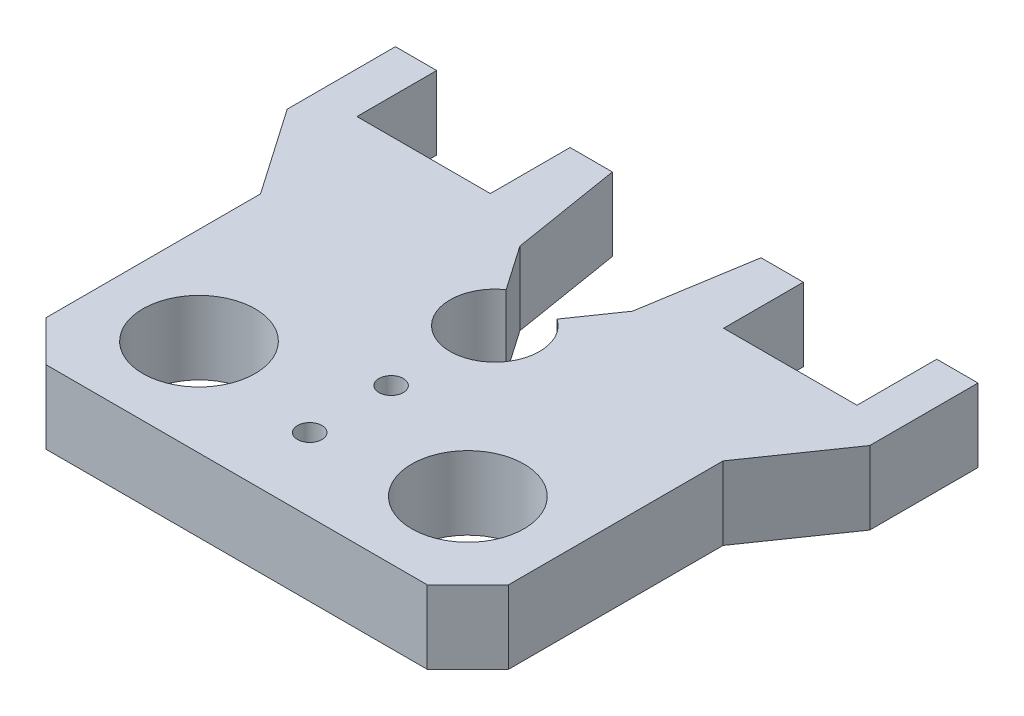
from build123d import *

# Parameters (mm, degrees)
SKETCH1_R           = 1.5
SKETCH1_R_2         = 6.9
BOSS_EXTRUDE1_DEPTH = 9
BOSS_EXTRUDE2_DEPTH = 9


with BuildPart() as part:
    # Sketch1 → Boss-Extrude1 (new body)
    with BuildSketch(Plane(origin=(0, 0, 0), x_dir=(1, 0, 0), z_dir=(0, 1, 0))):
        with BuildLine():
            Line((-11.652723828, -50.570490945), (4.846773171, -50.570490945))
            Line((4.846773171, -50.570490945), (8.637408256, -56.047889168))
            ThreePointArc((8.637408256, -56.047889168), (11.767276172, -66.070490945), (14.897144088, -56.047889168))
            Line((14.897144088, -56.047889168), (18.687779173, -50.570490945))
            Line((18.687779173, -50.570490945), (35.187276172, -50.570490945))
            Line((35.187276172, -50.570490945), (40.187276172, -55.570490945))
            Line((40.187276172, -55.570490945), (40.187276172, -87.300490945))
            Line((40.187276172, -87.300490945), (35.187276172, -92.300490945))
            Line((35.187276172, -92.300490945), (-11.652723828, -92.300490945))
            Line((-11.652723828, -92.300490945), (-16.652723828, -87.300490945))
            Line((-16.652723828, -87.300490945), (-16.652723828, -55.570490945))
            Line((-16.652723828, -55.570490945), (-11.652723828, -50.570490945))
        make_face()
        with Locations(Location((11.767276172, -73.315490945, 0), (0, 0, 270))):
            Circle(SKETCH1_R, mode=Mode.SUBTRACT)
        with Locations(Location((11.767276172, -83.315490945, 0), (0, 0, 270))):
            Circle(SKETCH1_R, mode=Mode.SUBTRACT)
        with Locations(Location((-4.752723828, -80.400490945, 0), (0, 0, 270))):
            Circle(SKETCH1_R_2, mode=Mode.SUBTRACT)
        with Locations(Location((28.287276172, -80.400490945, 0), (0, 0, 270))):
            Circle(SKETCH1_R_2, mode=Mode.SUBTRACT)
    extrude(amount=BOSS_EXTRUDE1_DEPTH)

    # Sketch2 → Boss-Extrude2 (add)
    with BuildSketch(Plane(origin=(0, 9, 0), x_dir=(1, 0, 0), z_dir=(0, 1, 0))):
        Polygon((26.099816941, -36.988069685), (20.899816941, -36.988069685), (18.687779173, -50.570490945), (35.187276172, -50.570490945), (40.187276172, -55.570490945), (40.187276172, -60.936255598), (47.560429658, -50.288069685), (47.560429658, -36.988069685), (42.490429658, -36.988069685), (42.490429658, -46.788069685), (26.099816941, -46.788069685), align=None)
        Polygon((-18.955877314, -36.988069685), (-24.025877314, -36.988069685), (-24.025877314, -50.288069685), (-16.652723828, -60.936255598), (-16.652723828, -55.570490945), (-11.652723828, -50.570490945), (4.846773171, -50.570490945), (2.634735403, -36.988069685), (-2.565264597, -36.988069685), (-2.565264597, -46.788069685), (-18.955877314, -46.788069685), align=None)
    extrude(amount=-BOSS_EXTRUDE2_DEPTH)


solid = part.part
